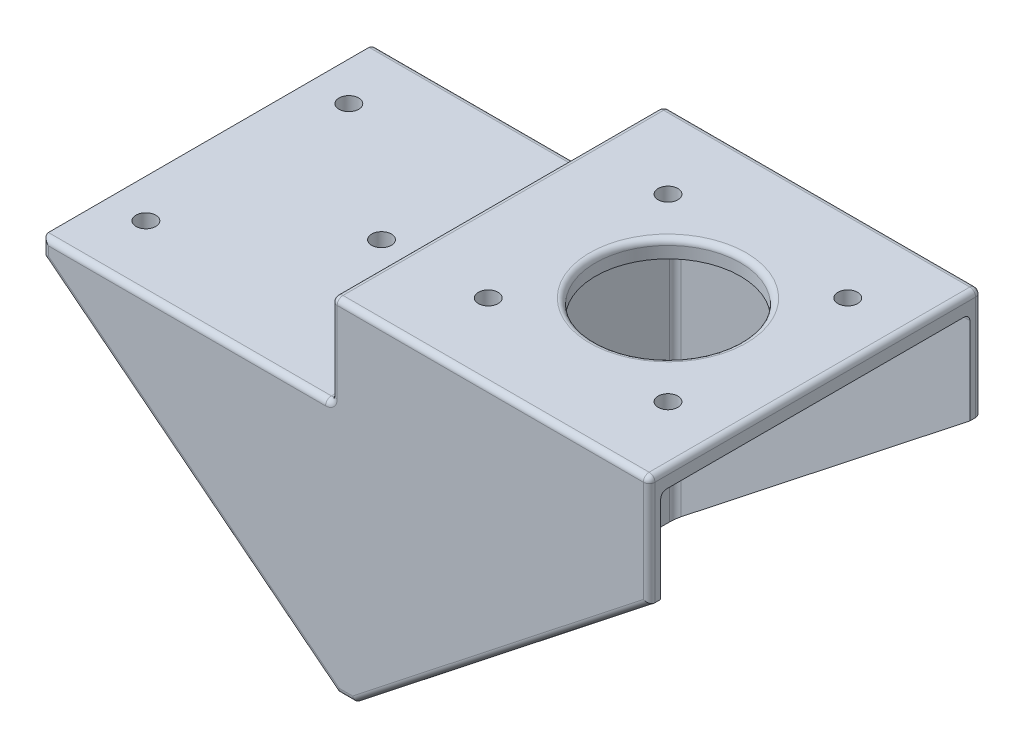
from build123d import *

# Parameters (mm, degrees)
SKETCH1_W            = 104.6
SKETCH1_H            = 57.3
BOSS_EXTRUDE1_DEPTH  = 3
SKETCH3_W            = 3
SKETCH3_H            = 57.3
BOSS_EXTRUDE3_DEPTH  = 40
M3_CLEARANCE_HOLE1_D = 3.4
BOSS_EXTRUDE4_DEPTH  = 2
SKETCH11_R           = 12.5
CUT_EXTRUDE1_DEPTH   = 72.806075648
M3_CLEARANCE_HOLE3_D = 3.4
SKETCH14_R           = 1.7
CUT_EXTRUDE2_DEPTH   = 74.51947021
BOSS_EXTRUDE5_START  = 16
SKETCH16_W           = 50.8
SKETCH16_H           = 57.3
SKETCH16_R           = 12.5
SKETCH16_R_2         = 1.7
BOSS_EXTRUDE5_DEPTH  = 16
SKETCH17_W           = 50.8
SKETCH17_H           = 53.3
CUT_EXTRUDE3_DEPTH   = 16
SKETCH18_W           = 57.3
SKETCH18_H           = 16
BOSS_EXTRUDE6_DEPTH  = 4
FILLET1_R            = 1


with BuildPart() as part:
    # Sketch1 → Boss-Extrude1 (new body)
    with BuildSketch(Plane(origin=(0, 0, 0), x_dir=(1, 0, 0), z_dir=(0, 1, 0))):
        Rectangle(SKETCH1_W, SKETCH1_H)
    extrude(amount=BOSS_EXTRUDE1_DEPTH)

    # Sketch3 → Boss-Extrude3 (add)
    with BuildSketch(Plane.XZ):
        Rectangle(SKETCH3_W, SKETCH3_H)
    extrude(amount=BOSS_EXTRUDE3_DEPTH)

    # M3 Clearance Hole1 (through all)
    with Locations(Plane(origin=(0, 0, 0), x_dir=(-1, 0, 0), z_dir=(0, -1, 0))):
        with Locations((-11.4, -15.5), (-42.4, 15.5), (-42.4, -15.5), (-11.4, 15.5)):
            Hole(M3_CLEARANCE_HOLE1_D / 2)

    # Sketch10 → Boss-Extrude4 (add)
    with BuildSketch(Plane.XY.offset(28.65)):
        Polygon((-52.3, 0), (-1.5, -40), (-1.5, 0), align=None)
        Polygon((1.5, -40), (52.3, 0), (1.5, 0), align=None)
    boss_extrude4 = extrude(amount=-BOSS_EXTRUDE4_DEPTH)

    # Mirror1: Boss-Extrude4 across plane
    add(boss_extrude4.mirror(Plane(origin=(0, 0, 0), x_dir=(1, 0, 0), z_dir=(0, 0, -1))))

    # Sketch11 → Cut-Extrude1 (cut, through all)
    with BuildSketch(Plane.XZ):
        with Locations(Location((26.9, 0, 0), (0, 0, 270))):
            Circle(SKETCH11_R)
    extrude(amount=-CUT_EXTRUDE1_DEPTH, mode=Mode.SUBTRACT)

    # M3 Clearance Hole3 (through all)
    with Locations(Plane(origin=(0, 0, 0), x_dir=(-1, 0, 0), z_dir=(0, -1, 0))):
        with Locations((45.638207547, -17.5), (8.161792453, 17.5), (8.161792453, -17.5), (45.638207547, 17.5)):
            Hole(M3_CLEARANCE_HOLE3_D / 2)

    # Sketch14 → Cut-Extrude2 (cut, through all)
    with BuildSketch(Plane(origin=(0, 3, 0), x_dir=(1, 0, 0), z_dir=(0, 1, 0))):
        with Locations(Location((-12.5, -4e-09, 0), (0, 0, 270))):
            Circle(SKETCH14_R)
        with Locations(Location((-22.5, -4e-09, 0), (0, 0, 270))):
            Circle(SKETCH14_R)
    extrude(amount=-CUT_EXTRUDE2_DEPTH, mode=Mode.SUBTRACT)

    # Sketch16 → Boss-Extrude5 (add)
    with BuildSketch(Plane(origin=(0, 3, 0), x_dir=(1, 0, 0), z_dir=(0, 1, 0)).offset(BOSS_EXTRUDE5_START)):
        with Locations((26.9, 0)):
            Rectangle(SKETCH16_W, SKETCH16_H)
        with Locations(Location((26.9, 0, 0), (0, 0, 90))):
            Circle(SKETCH16_R, mode=Mode.SUBTRACT)
        with Locations(Location((42.4, 15.5, 0), (0, 0, 90))):
            Circle(SKETCH16_R_2, mode=Mode.SUBTRACT)
        with Locations(Location((42.4, -15.5, 0), (0, 0, 90))):
            Circle(SKETCH16_R_2, mode=Mode.SUBTRACT)
        with Locations(Location((11.4, -15.5, 0), (0, 0, 90))):
            Circle(SKETCH16_R_2, mode=Mode.SUBTRACT)
        with Locations(Location((11.4, 15.5, 0), (0, 0, 90))):
            Circle(SKETCH16_R_2, mode=Mode.SUBTRACT)
    extrude(amount=-BOSS_EXTRUDE5_DEPTH)

    # Sketch17 → Cut-Extrude3 (cut)
    with BuildSketch(Plane.XZ):
        with Locations((26.9, 0)):
            Rectangle(SKETCH17_W, SKETCH17_H)
    extrude(amount=-CUT_EXTRUDE3_DEPTH, mode=Mode.SUBTRACT)

    # Sketch18 → Boss-Extrude6 (add)
    with BuildSketch(Plane.ZY.offset(-1.5)):
        with Locations((0, 11)):
            Rectangle(SKETCH18_W, SKETCH18_H)
    extrude(amount=BOSS_EXTRUDE6_DEPTH)

    # Fillet1
    fillet1_edges = [part.edges().sort_by_distance(p)[0] for p in [
        (52.3, 19, 0),
        (24.9, 19, -28.65),
        (24.9, 19, 28.65),
        (26.9, 19, 12.5),
        (1.5, 16, 0),
        (26.9, 16, 26.65),
        (26.9, 16, -26.65),
        (-27.4, 3, 28.65),
        (0, -40, -28.65),
        (-27.4, 3, -28.65),
        (-2.5, 11, -28.65),
        (-2.5, 3, 0),
        (-2.5, 11, 28.65),
        (-2.5, 19, 0),
        (0, -40, 28.65),
        (-1.5, 0, 0),
        (-26.9, 0, 26.65),
        (-1.5, -20, 26.65),
        (-26.9, -20, 28.65),
        (1.5, -12, 26.65),
        (26.9, -20, 28.65),
        (-26.9, -20, -28.65),
        (-26.9, 0, -26.65),
        (-1.5, -20, -26.65),
        (52.3, 9.5, 28.65),
        (-52.3, 1.5, 28.65),
        (26.9, -20, -28.65),
        (-52.3, 1.5, -28.65),
        (1.5, -12, -26.65),
        (52.3, 9.5, -28.65),
    ]]
    fillet(fillet1_edges, radius=FILLET1_R)


solid = part.part
